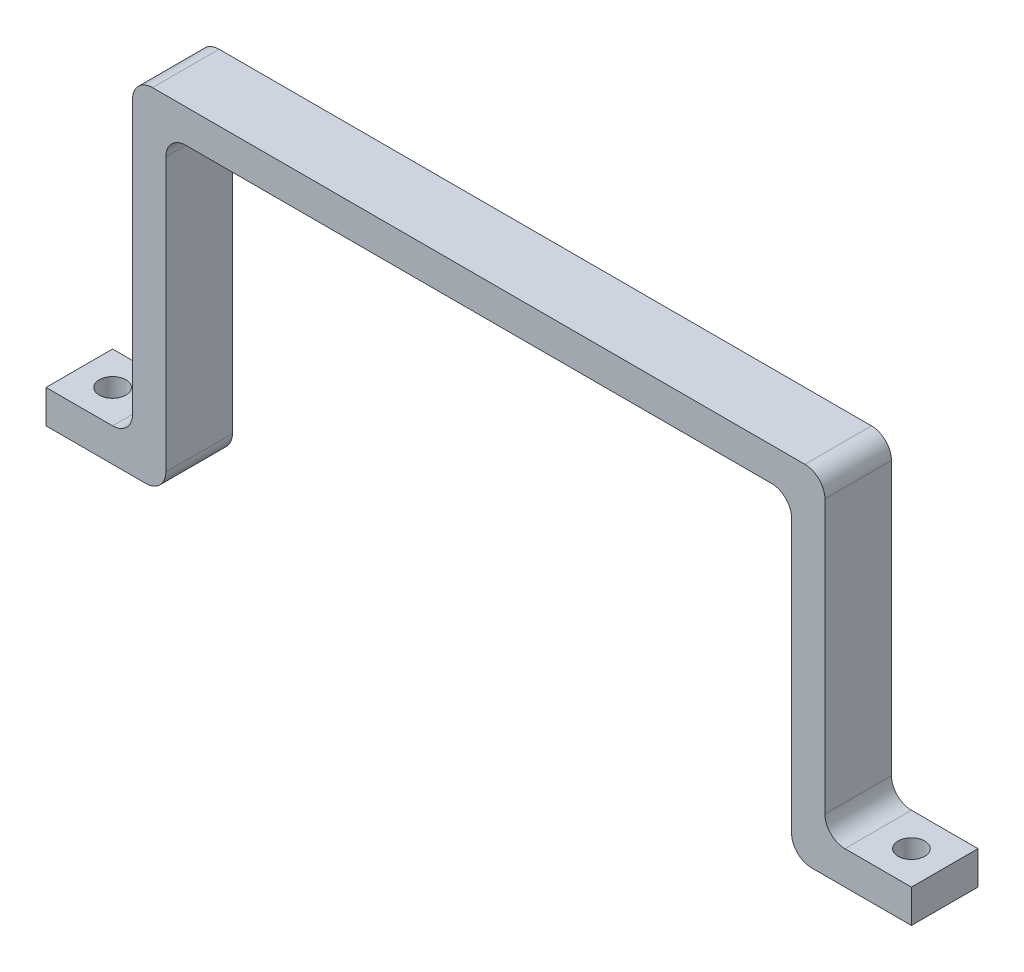
from build123d import *

# Parameters (mm, degrees)
BOSS_EXTRUDE1_DEPTH = 10
SKETCH2_R           = 2
CUT_EXTRUDE1_DEPTH  = 81.833161512


with BuildPart() as part:
    # Sketch1 → Boss-Extrude1 (new body)
    with BuildSketch(Plane.XY):
        with BuildLine():
            Line((52, -15.5), (52, 25.5))
            ThreePointArc((52, 25.5), (51.121320344, 27.621320344), (49, 28.5))
            Line((49, 28.5), (-49, 28.5))
            ThreePointArc((-49, 28.5), (-51.121320344, 27.621320344), (-52, 25.5))
            Line((-52, 25.5), (-52, -15.5))
            ThreePointArc((-52, -15.5), (-52.878679656, -17.621320344), (-55, -18.5))
            Line((-55, -18.5), (-65, -18.5))
            Line((-65, -18.5), (-65, -23.5))
            Line((-65, -23.5), (-52, -23.5))
            Line((-52, -23.5), (-50, -23.5))
            ThreePointArc((-50, -23.5), (-47.878679656, -22.621320344), (-47, -20.5))
            Line((-47, -20.5), (-47, 20.5))
            ThreePointArc((-47, 20.5), (-46.121320344, 22.621320344), (-44, 23.5))
            Line((-44, 23.5), (44, 23.5))
            ThreePointArc((44, 23.5), (46.121320344, 22.621320344), (47, 20.5))
            Line((47, 20.5), (47, -20.5))
            ThreePointArc((47, -20.5), (47.878679656, -22.621320344), (50, -23.5))
            Line((50, -23.5), (52, -23.5))
            Line((52, -23.5), (65, -23.5))
            Line((65, -23.5), (65, -18.5))
            Line((65, -18.5), (55, -18.5))
            ThreePointArc((55, -18.5), (52.878679656, -17.621320344), (52, -15.5))
        make_face()
    extrude(amount=BOSS_EXTRUDE1_DEPTH)

    # Sketch2 → Cut-Extrude1 (cut, through all)
    with BuildSketch(Plane(origin=(0, -18.5, 0), x_dir=(1, 0, 0), z_dir=(0, 1, 0))):
        with Locations(Location((-60, -5, 0), (0, 0, 270))):
            Circle(SKETCH2_R)
        with Locations(Location((60, -5, 0), (0, 0, 270))):
            Circle(SKETCH2_R)
    extrude(amount=-CUT_EXTRUDE1_DEPTH, mode=Mode.SUBTRACT)


solid = part.part
